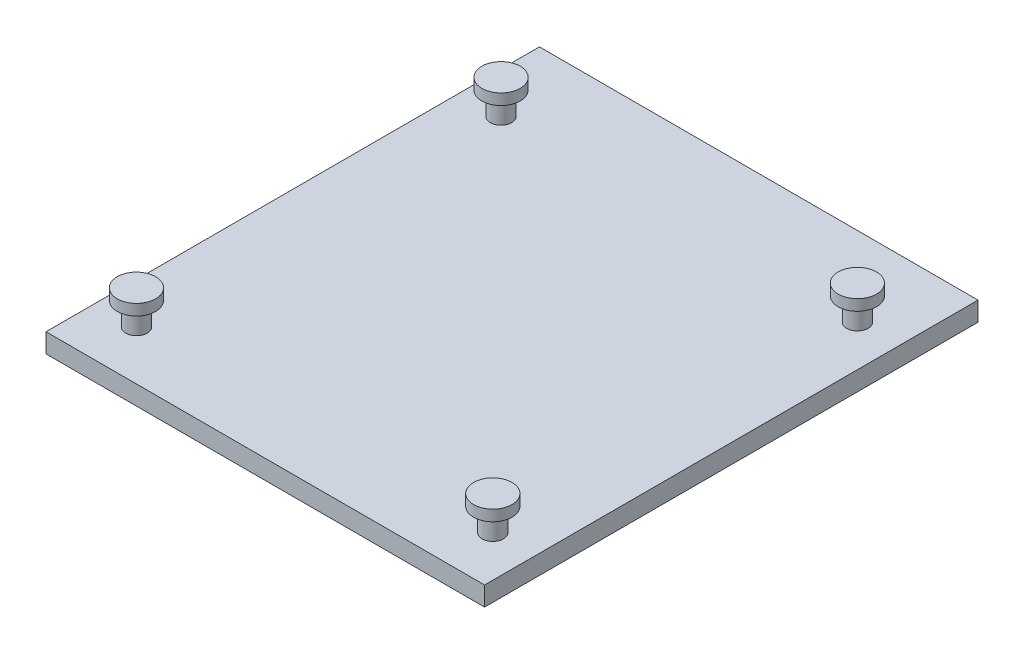
from build123d import *

# Parameters (mm, degrees)
SKETCH1_W           = 80
SKETCH1_H           = 90
BOSS_EXTRUDE1_DEPTH = 3.5
SKETCH2_R           = 1.95
BOSS_EXTRUDE2_DEPTH = 4.2
SKETCH3_R           = 3.5
BOSS_EXTRUDE3_DEPTH = 2


with BuildPart() as part:
    # Sketch1 → Boss-Extrude1 (new body)
    with BuildSketch(Plane(origin=(0, 0, 0), x_dir=(1, 0, 0), z_dir=(0, 1, 0))):
        Rectangle(SKETCH1_W, SKETCH1_H)
    extrude(amount=-BOSS_EXTRUDE1_DEPTH)

    # Sketch2 → Boss-Extrude2 (add)
    with BuildSketch(Plane(origin=(0, 0, 0), x_dir=(1, 0, 0), z_dir=(0, 1, 0))):
        with Locations(Location((-32.5, 30.5, 0), (0, 0, 90))):
            Circle(SKETCH2_R)
        with Locations(Location((32.5, 30.5, 0), (0, 0, 90))):
            Circle(SKETCH2_R)
        with Locations(Location((32.5, -36, 0), (0, 0, 90))):
            Circle(SKETCH2_R)
        with Locations(Location((-32.5, -36, 0), (0, 0, 90))):
            Circle(SKETCH2_R)
    extrude(amount=BOSS_EXTRUDE2_DEPTH)

    # Sketch3 → Boss-Extrude3 (add)
    with BuildSketch(Plane(origin=(0, 4.2, 0), x_dir=(1, 0, 0), z_dir=(0, 1, 0))):
        with Locations(Location((-32.5, 30.5, 0), (0, 0, 270))):
            Circle(SKETCH3_R)
        with Locations(Location((32.5, 30.5, 0), (0, 0, 270))):
            Circle(SKETCH3_R)
        with Locations(Location((-32.5, -36, 0), (0, 0, 270))):
            Circle(SKETCH3_R)
        with Locations(Location((32.5, -36, 0), (0, 0, 270))):
            Circle(SKETCH3_R)
    extrude(amount=BOSS_EXTRUDE3_DEPTH)


solid = part.part
